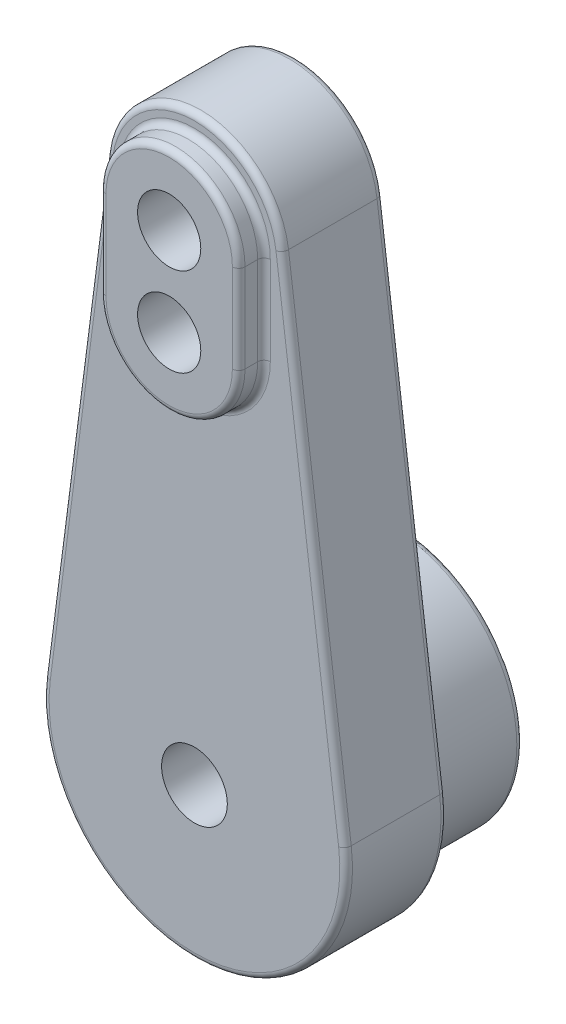
from build123d import *

# Parameters (mm, degrees)
SKETCH1_R           = 1.3
BOSS_EXTRUDE1_DEPTH = 4
BOSS_EXTRUDE2_DEPTH = 1
SKETCH3_R           = 5
SKETCH3_R_2         = 3
BOSS_EXTRUDE3_DEPTH = 4
SKETCH4_R           = 1.25
CUT_EXTRUDE1_DEPTH  = 5
FILLET1_R           = 0.25


with BuildPart() as part:
    # Sketch1 → Boss-Extrude1 (new body)
    with BuildSketch(Plane.XY):
        with BuildLine():
            Line((-3.471116852, 19.948717949), (-5.950486033, 0.769230769))
            ThreePointArc((-5.950486033, 0.769230769), (0, -6), (5.950486033, 0.769230769))
            Line((5.950486033, 0.769230769), (3.471116852, 19.948717949))
            ThreePointArc((3.471116852, 19.948717949), (0, 23), (-3.471116852, 19.948717949))
        make_face()
        Circle(SKETCH1_R, mode=Mode.SUBTRACT)
    extrude(amount=-BOSS_EXTRUDE1_DEPTH)

    # Sketch2 → Boss-Extrude2 (add)
    with BuildSketch(Plane.XY):
        with BuildLine():
            Line((-2.75, 19.5), (-2.75, 16))
            ThreePointArc((-2.75, 16), (0, 13.25), (2.75, 16))
            Line((2.75, 16), (2.75, 19.5))
            ThreePointArc((2.75, 19.5), (0, 22.25), (-2.75, 19.5))
        make_face()
    extrude(amount=BOSS_EXTRUDE2_DEPTH)

    # Sketch3 → Boss-Extrude3 (add)
    with BuildSketch(Plane(origin=(0, 0, -4), x_dir=(-1, 0, 0), z_dir=(0, 0, -1))):
        with Locations(Location((0, 0, 0), (0, 0, 180))):
            Circle(SKETCH3_R)
        Circle(SKETCH3_R_2, mode=Mode.SUBTRACT)
    extrude(amount=BOSS_EXTRUDE3_DEPTH)

    # Sketch4 → Cut-Extrude1 (cut)
    with BuildSketch(Plane.XY.offset(1)):
        with Locations((0, 19.5)):
            Circle(SKETCH4_R)
        with Locations((0, 16)):
            Circle(SKETCH4_R)
    extrude(amount=-CUT_EXTRUDE1_DEPTH, mode=Mode.SUBTRACT)

    # Fillet1
    fillet1_edges = [part.edges().sort_by_distance(p)[0] for p in [
        (0, -6, -4),
        (4.710801442, 10.358974359, -4),
        (0, 22.25, 0),
        (-2.75, 17.75, 0),
        (0, 13.25, 0),
        (2.75, 17.75, 0),
        (0, 22.25, 1),
        (-2.75, 17.75, 1),
        (0, 13.25, 1),
        (2.75, 17.75, 1),
        (-5, 0, -4),
        (-5, 0, -8),
        (0, 23, -4),
        (4.710801442, 10.358974359, 0),
        (0, -6, 0),
        (-4.710801442, 10.358974359, 0),
        (0, 23, 0),
        (-4.710801442, 10.358974359, -4),
    ]]
    fillet(fillet1_edges, radius=FILLET1_R)


solid = part.part
